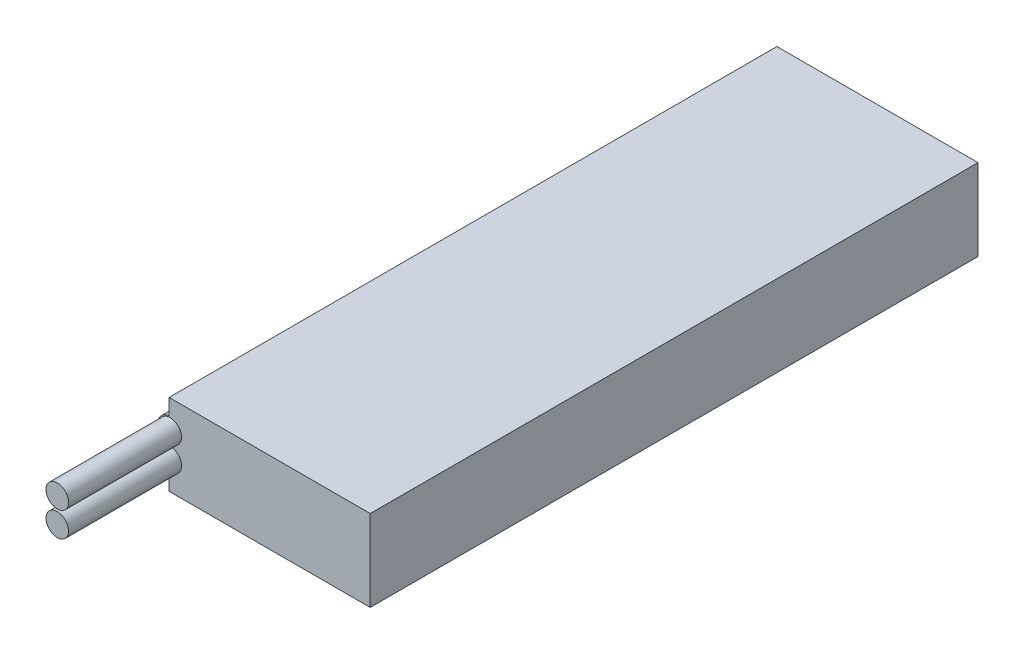
from build123d import *

# Parameters (mm, degrees)
SKETCH1_W           = 44.5
SKETCH1_H           = 134.5
BOSS_EXTRUDE1_DEPTH = 18
BOSS_EXTRUDE2_DEPTH = 7
SKETCH5_R           = 2.5
BOSS_EXTRUDE4_DEPTH = 25


with BuildPart() as part:
    # Sketch1 → Boss-Extrude1 (new body)
    with BuildSketch(Plane(origin=(0, 0, 0), x_dir=(1, 0, 0), z_dir=(0, 1, 0))):
        Rectangle(SKETCH1_W, SKETCH1_H)
    extrude(amount=BOSS_EXTRUDE1_DEPTH)

    # Sketch3 → Boss-Extrude2 (add)
    with BuildSketch(Plane.XY.offset(67.25)):
        with BuildLine():
            Line((-22.25, 14.488612788), (-22.25, 3.511387212))
            ThreePointArc((-22.25, 3.511387212), (-24.031009601, 4.395950378), (-24.75, 6.25))
            Line((-24.75, 6.25), (-24.75, 11.75))
            ThreePointArc((-24.75, 11.75), (-24.031009601, 13.604049622), (-22.25, 14.488612788))
        make_face()
    extrude(amount=-BOSS_EXTRUDE2_DEPTH)

    # Sketch5 → Boss-Extrude4 (add)
    with BuildSketch(Plane.XY.offset(67.25)):
        with Locations(Location((-22, 11.75, 0), (0, 0, 180))):
            Circle(SKETCH5_R)
        with Locations(Location((-22, 6.25, 0), (0, 0, 180))):
            Circle(SKETCH5_R)
    extrude(amount=BOSS_EXTRUDE4_DEPTH)


solid = part.part
